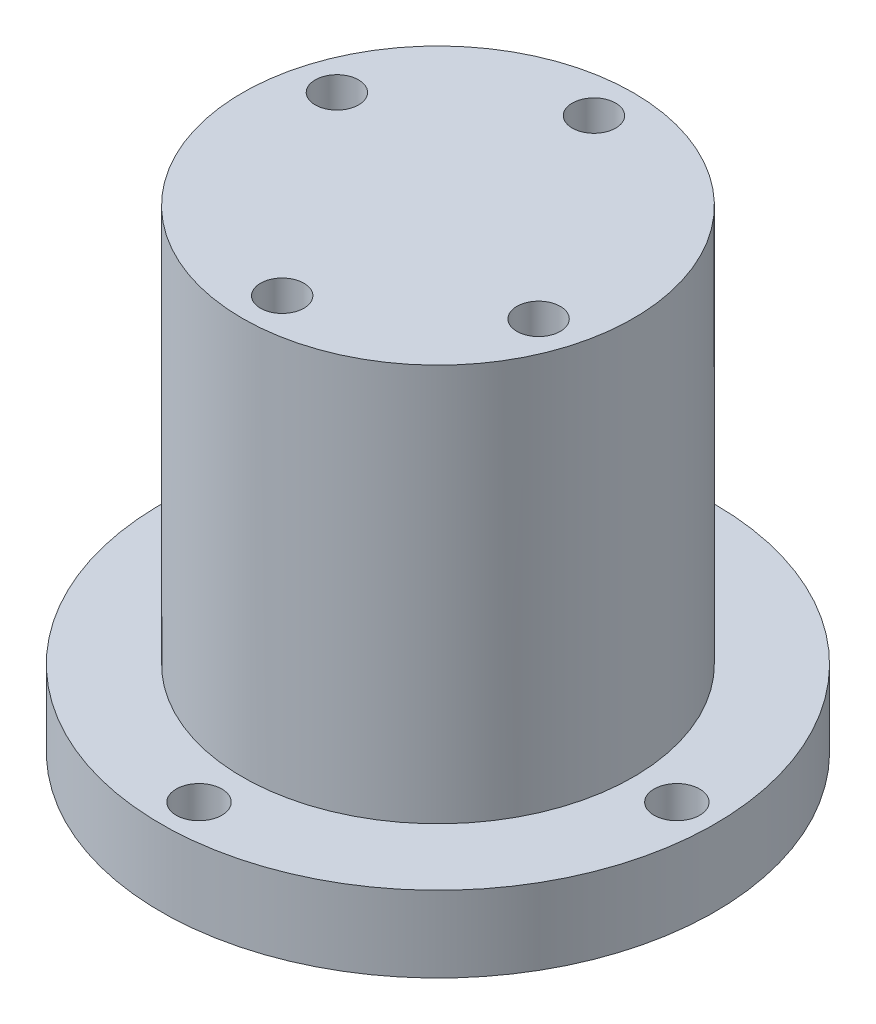
from build123d import *

# Parameters (mm, degrees)
SKETCH_1_R          = 18
EXTRUDE_1_DEPTH     = 43.573
SKETCH_3_R          = 25.5
SKETCH_3_R_2        = 2.1
EXTRUDE_2_DEPTH     = 7
SKETCH_2_R          = 2
CUT_EXTRUDE_1_DEPTH = 10


with BuildPart() as part:
    # Эскиз1 → Бобышка-Вытянуть1 (new body)
    with BuildSketch(Plane(origin=(0, 0, 0), x_dir=(1, 0, 0), z_dir=(0, 1, 0))):
        with Locations(Location((0, 0, 0), (0, 0, 270))):
            Circle(SKETCH_1_R)
    extrude(amount=EXTRUDE_1_DEPTH)

    # Эскиз3 → Бобышка-Вытянуть2 (add)
    with BuildSketch(Plane.XZ):
        with Locations(Location((0, 0, 0), (0, 0, 270))):
            Circle(SKETCH_3_R)
        with Locations(Location((0, 22, 0), (0, 0, 270))):
            Circle(SKETCH_3_R_2, mode=Mode.SUBTRACT)
        with Locations(Location((-22, 0, 0), (0, 0, 270))):
            Circle(SKETCH_3_R_2, mode=Mode.SUBTRACT)
        with Locations(Location((0, -22, 0), (0, 0, 270))):
            Circle(SKETCH_3_R_2, mode=Mode.SUBTRACT)
        with Locations(Location((22, 0, 0), (0, 0, 270))):
            Circle(SKETCH_3_R_2, mode=Mode.SUBTRACT)
    extrude(amount=-EXTRUDE_2_DEPTH)

    # Эскиз2 → Вырез-Вытянуть1 (cut)
    with BuildSketch(Plane(origin=(0, 43.573, 0), x_dir=(1, 0, 0), z_dir=(0, 1, 0))):
        with Locations(Location((0.008308586, 14.359840693, 0), (0, 0, 270))):
            Circle(SKETCH_2_R)
        with Locations(Location((13.669247008, -4.399634075, 0), (0, 0, 270))):
            Circle(SKETCH_2_R)
        with Locations(Location((0.018947935, -14.359830595, 0), (0, 0, 270))):
            Circle(SKETCH_2_R)
        with Locations(Location((-13.677573358, 4.373680464, 0), (0, 0, 270))):
            Circle(SKETCH_2_R)
    extrude(amount=-CUT_EXTRUDE_1_DEPTH, mode=Mode.SUBTRACT)


solid = part.part
